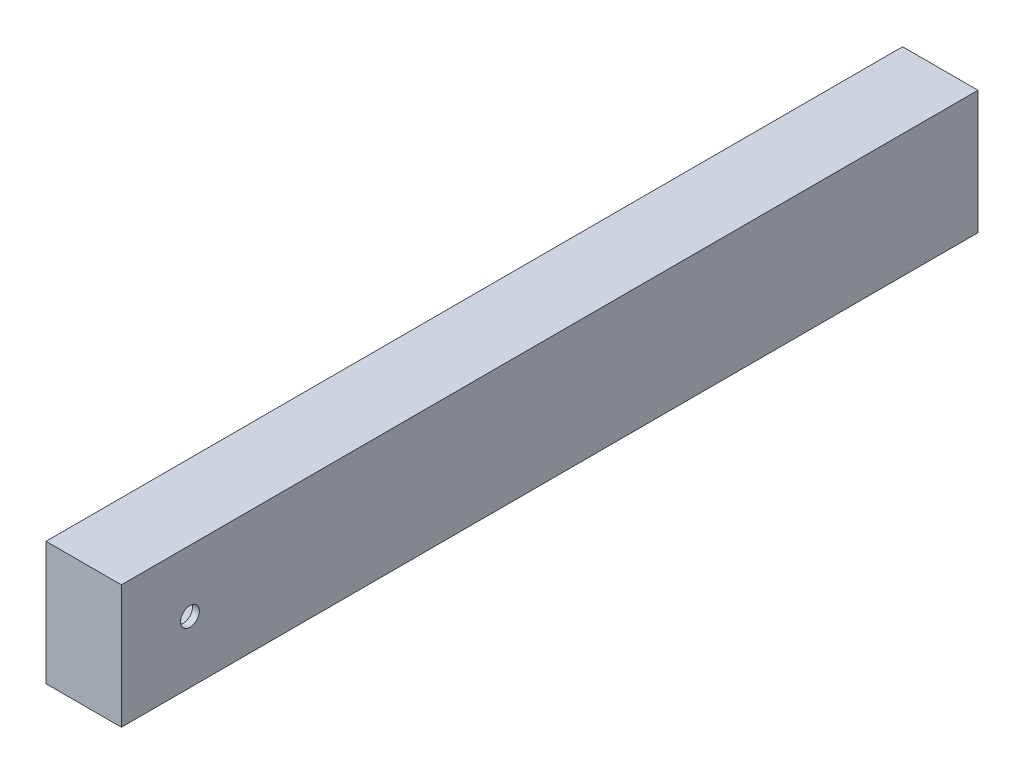
from build123d import *

# Parameters (mm, degrees)
ESBO_O1_W                = 22
ESBO_O1_H                = 36
RESSALTO_EXTRUS_O1_DEPTH = 250
CASCA1_T                 = -2
ESBO_O2_R                = 5
CORTE_EXTRUS_O1_DEPTH    = 10
ESBO_O3_R                = 2.75
CORTE_EXTRUS_O2_DEPTH    = 29


with BuildPart() as part:
    # Esboço1 → Ressalto-extrusão1 (new body)
    with BuildSketch(Plane.XY):
        with Locations((0, 18)):
            Rectangle(ESBO_O1_W, ESBO_O1_H)
    extrude(amount=RESSALTO_EXTRUS_O1_DEPTH)

    # Casca1
    casca1_openings = [part.faces().sort_by_distance(p)[0] for p in [
        (0, 18, 0),
    ]]
    offset(amount=CASCA1_T, openings=casca1_openings, kind=Kind.INTERSECTION)

    # Esboço2 → Corte-extrusão1 (cut)
    with BuildSketch(Plane(origin=(0, 0, 0), x_dir=(-1, 0, 0), z_dir=(0, -1, 0))):
        with Locations(Location((0, -20, 0), (0, 0, 90))):
            Circle(ESBO_O2_R)
        with Locations(Location((0, -40, 0), (0, 0, 90))):
            Circle(ESBO_O2_R)
        with Locations(Location((0, -60, 0), (0, 0, 90))):
            Circle(ESBO_O2_R)
        with Locations(Location((0, -80, 0), (0, 0, 90))):
            Circle(ESBO_O2_R)
        with Locations(Location((0, -100, 0), (0, 0, 90))):
            Circle(ESBO_O2_R)
    extrude(amount=-CORTE_EXTRUS_O1_DEPTH, mode=Mode.SUBTRACT)

    # Esboço3 → Corte-extrusão2 (cut)
    with BuildSketch(Plane(origin=(11, 0, 0), x_dir=(0, 0, -1), z_dir=(1, 0, 0))):
        with Locations(Location((-230, 18, 0), (0, 0, 90))):
            Circle(ESBO_O3_R)
    extrude(amount=-CORTE_EXTRUS_O2_DEPTH, mode=Mode.SUBTRACT)


solid = part.part
